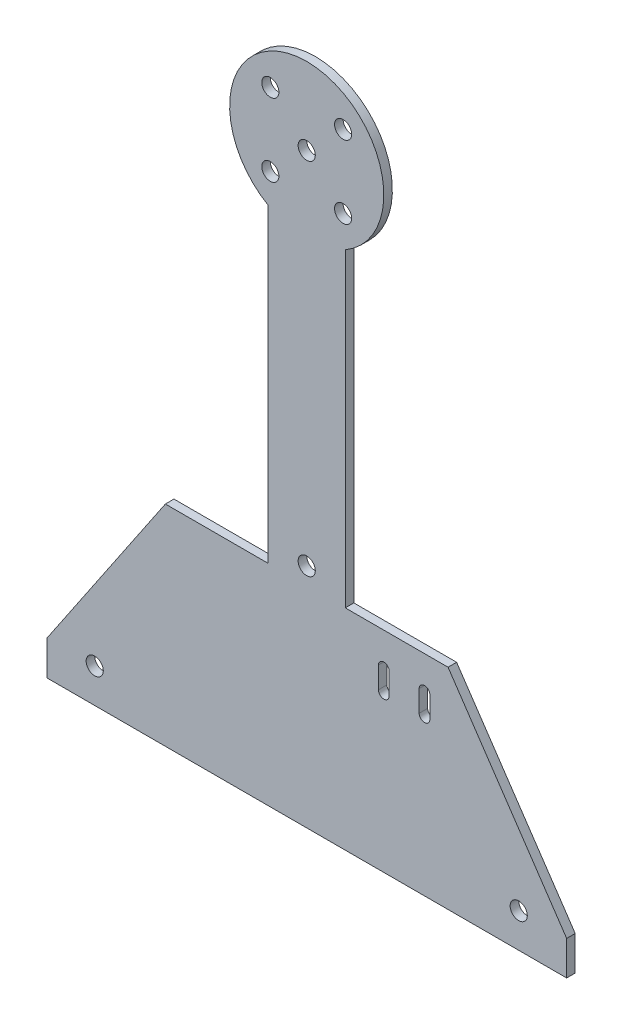
from build123d import *

# Parameters (mm, degrees)
SKETCH_1_R      = 2
EXTRUDE_1_DEPTH = 2


with BuildPart() as part:
    # 草图1 → 凸台-拉伸1 (new body)
    with BuildSketch(Plane.XY):
        with BuildLine():
            Line((-9.291428571, 106.057257018), (-9.291428571, 33.645714286))
            Line((-9.291428571, 33.645714286), (-33.291428571, 33.645714286))
            Line((-33.291428571, 33.645714286), (-60.986481548, -7.354285714))
            Line((-60.986481548, -7.354285714), (-60.986481548, -15.354285714))
            Line((-60.986481548, -15.354285714), (60.403624405, -15.354285714))
            Line((60.403624405, -15.354285714), (60.403624405, -7.354285714))
            Line((60.403624405, -7.354285714), (32.708571429, 33.645714286))
            Line((32.708571429, 33.645714286), (8.708571429, 33.645714286))
            Line((8.708571429, 33.645714286), (8.708571429, 106.057257018))
            ThreePointArc((8.708571429, 106.057257018), (-0.291428571, 139.645714286), (-9.291428571, 106.057257018))
        make_face()
        with Locations((-49.791428571, -7.354285714)):
            Circle(SKETCH_1_R, mode=Mode.SUBTRACT)
        with Locations((-0.291428571, 37.645714286)):
            Circle(SKETCH_1_R, mode=Mode.SUBTRACT)
        with Locations((49.208571429, -7.354285714)):
            Circle(SKETCH_1_R, mode=Mode.SUBTRACT)
        with BuildLine():
            ThreePointArc((16.453130984, 25.945714286), (17.703130984, 27.195714286), (18.953130984, 25.945714286))
            Line((18.953130984, 25.945714286), (18.953130984, 20.945714286))
            ThreePointArc((18.953130984, 20.945714286), (17.703130984, 19.695714286), (16.453130984, 20.945714286))
            Line((16.453130984, 20.945714286), (16.453130984, 25.945714286))
        make_face(mode=Mode.SUBTRACT)
        with BuildLine():
            ThreePointArc((25.953130984, 25.945714286), (27.203130984, 27.195714286), (28.453130984, 25.945714286))
            Line((28.453130984, 25.945714286), (28.453130984, 20.945714286))
            ThreePointArc((28.453130984, 20.945714286), (27.203130984, 19.695714286), (25.953130984, 20.945714286))
            Line((25.953130984, 20.945714286), (25.953130984, 25.945714286))
        make_face(mode=Mode.SUBTRACT)
        with Locations((8.208571429, 130.145714286)):
            Circle(SKETCH_1_R, mode=Mode.SUBTRACT)
        with Locations((-8.791428571, 113.145714286)):
            Circle(SKETCH_1_R, mode=Mode.SUBTRACT)
        with Locations((-0.291428571, 121.645714286)):
            Circle(SKETCH_1_R, mode=Mode.SUBTRACT)
        with Locations((-8.791428571, 130.145714286)):
            Circle(SKETCH_1_R, mode=Mode.SUBTRACT)
        with Locations((8.208571429, 113.145714286)):
            Circle(SKETCH_1_R, mode=Mode.SUBTRACT)
    extrude(amount=EXTRUDE_1_DEPTH)


solid = part.part
